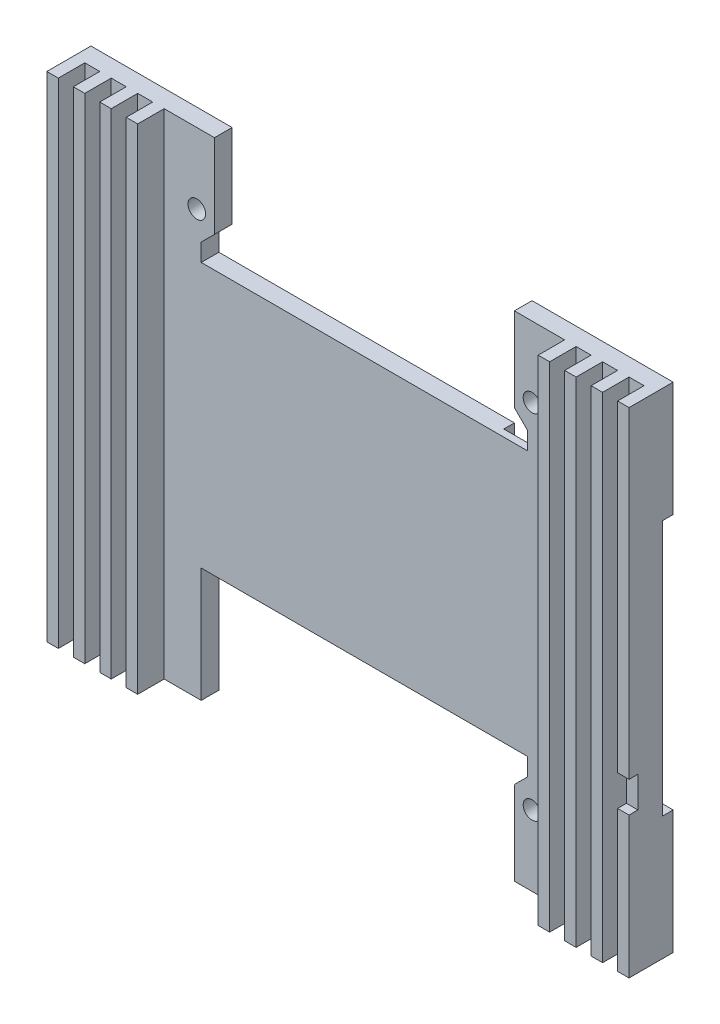
from build123d import *

# Parameters (mm, degrees)
SKETCH_1_R          = 1
EXTRUDE_1_DEPTH     = 2
SKETCH_2_W          = 1.3
SKETCH_2_H          = 56
EXTRUDE_2_DEPTH     = 3
SKETCH_3_W          = 10
SKETCH_3_H          = 11
SKETCH_3_W_2        = 20
SKETCH_3_H_2        = 14
CUT_EXTRUDE_1_DEPTH = 1.2
SKETCH_4_W          = 1.3
SKETCH_4_H          = 3.5
CUT_EXTRUDE_2_DEPTH = 1


with BuildPart() as part:
    # 草图1 → 凸台-拉伸1 (new body)
    with BuildSketch(Plane.XY):
        Polygon((18.5, 15), (-18.5, 15), (-18.5, 17), (-17, 18.5), (-17, 28), (-33, 28), (-33, -28), (-18.5, -28), (-18.5, -17), (-18.5, -15), (18.5, -15), (18.5, -17), (17, -18.5), (17, -28), (33, -28), (33, 28), (17, 28), (17, 18.5), (18.5, 17), align=None)
        with Locations((19, -20)):
            Circle(SKETCH_1_R, mode=Mode.SUBTRACT)
        with Locations((-19, 20)):
            Circle(SKETCH_1_R, mode=Mode.SUBTRACT)
        with Locations((19, 20)):
            Circle(SKETCH_1_R, mode=Mode.SUBTRACT)
    extrude(amount=EXTRUDE_1_DEPTH)

    # 草图2 → 凸台-拉伸2 (add)
    with BuildSketch(Plane.XY.offset(2)):
        with Locations((-32.35, 0)):
            Rectangle(SKETCH_2_W, SKETCH_2_H)
        with Locations((32.35, 0)):
            Rectangle(SKETCH_2_W, SKETCH_2_H)
        with Locations((-29.35, 0)):
            Rectangle(SKETCH_2_W, SKETCH_2_H)
        with Locations((-26.35, 0)):
            Rectangle(SKETCH_2_W, SKETCH_2_H)
        with Locations((-23.35, 0)):
            Rectangle(SKETCH_2_W, SKETCH_2_H)
        with Locations((29.35, 0)):
            Rectangle(SKETCH_2_W, SKETCH_2_H)
        with Locations((26.35, 0)):
            Rectangle(SKETCH_2_W, SKETCH_2_H)
        with Locations((23.35, 0)):
            Rectangle(SKETCH_2_W, SKETCH_2_H)
    extrude(amount=EXTRUDE_2_DEPTH)

    # 草图3 → 切除-拉伸1 (cut)
    with BuildSketch(Plane(origin=(0, 0, 0), x_dir=(-1, 0, 0), z_dir=(0, 0, -1))):
        Polygon((-15, -3), (-15, 15), (-18.5, 15), (-33, 15), (-33, -3), (-23, -3), align=None)
        with Locations((-28, -8.5)):
            Rectangle(SKETCH_3_W, SKETCH_3_H)
        with Locations((0, 4)):
            Rectangle(SKETCH_3_W_2, SKETCH_3_H_2)
    extrude(amount=-CUT_EXTRUDE_1_DEPTH, mode=Mode.SUBTRACT)

    # 草图4 → 切除-拉伸2 (cut)
    with BuildSketch(Plane.XY.offset(5)):
        with Locations((32.35, -10.25)):
            Rectangle(SKETCH_4_W, SKETCH_4_H)
    extrude(amount=-CUT_EXTRUDE_2_DEPTH, mode=Mode.SUBTRACT)


solid = part.part
